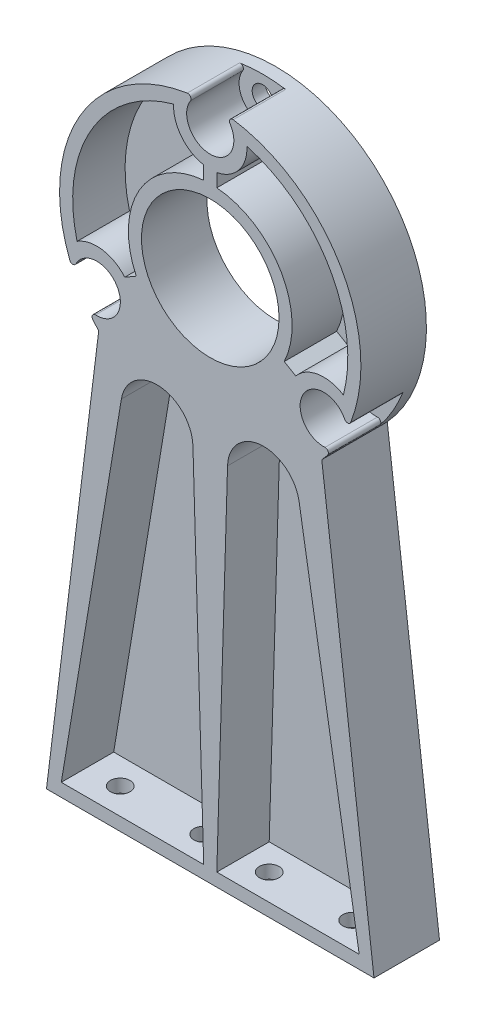
from build123d import *

# Parameters (mm, degrees)
SKETCH_1_R          = 10.5
EXTRUDE_1_DEPTH     = 10
CUT_EXTRUDE_2_DEPTH = 8
SKETCH_3_R          = 1.5
CUT_EXTRUDE_3_DEPTH = 97.81941954
EXTRUDE_START       = -10
SKETCH_4_R          = 1.6
EXTRUDE_3_DEPTH     = 10
CUT_EXTRUDE_START   = -10
SKETCH_5_R          = 1.6
CUT_EXTRUDE_4_DEPTH = 10
CUT_EXTRUDE_START_2 = -8
SKETCH_6_R          = 1.6
CUT_EXTRUDE_5_DEPTH = 8
FILLET_1_R          = 0.5


with BuildPart() as part:
    # 草图1 → 凸台-拉伸1 (new body)
    with BuildSketch(Plane.XY):
        with BuildLine():
            Line((-25, 0), (25, 0))
            Line((25, 0), (14.88676655, 81.839614547))
            ThreePointArc((14.88676655, 81.839614547), (0, 95), (-14.88676655, 81.839614547))
            Line((-14.88676655, 81.839614547), (-25, 0))
        make_face()
        with Locations((0, 80)):
            Circle(SKETCH_1_R, mode=Mode.SUBTRACT)
    extrude(amount=EXTRUDE_1_DEPTH)

    # 草图2 → 切除-拉伸2 (cut)
    with BuildSketch(Plane.XY.offset(10)):
        with BuildLine():
            Line((-13.564970556, 57.262621959), (-22.737639737, 2))
            Line((-22.737639737, 2), (-1, 2))
            Line((-1, 2), (-2.641694958, 56.527552532))
            ThreePointArc((-2.641694958, 56.527552532), (-7.769922801, 61.84962447), (-13.564970556, 57.262621959))
        make_face()
        with BuildLine():
            Line((2.641694958, 56.527552532), (1, 2))
            Line((1, 2), (22.737639737, 2))
            Line((22.737639737, 2), (13.564970556, 57.262621959))
            ThreePointArc((13.564970556, 57.262621959), (7.769922801, 61.84962447), (2.641694958, 56.527552532))
        make_face()
    extrude(amount=-CUT_EXTRUDE_2_DEPTH, mode=Mode.SUBTRACT)

    # 草图3 → 切除-拉伸3 (cut, through all)
    with BuildSketch(Plane(origin=(0, 2, 0), x_dir=(1, 0, 0), z_dir=(0, 1, 0))):
        with Locations(Location((-17.74, -6, 0), (0, 0, 180))):
            Circle(SKETCH_3_R)
        with Locations(Location((-5, -6, 0), (0, 0, 180))):
            Circle(SKETCH_3_R)
        with Locations(Location((5, -6, 0), (0, 0, 180))):
            Circle(SKETCH_3_R)
        with Locations(Location((17.74, -6, 0), (0, 0, 180))):
            Circle(SKETCH_3_R)
    extrude(amount=-CUT_EXTRUDE_3_DEPTH, mode=Mode.SUBTRACT)

    # 草图4 → 凸台-拉伸3 (add)
    with BuildSketch(Plane.XY.offset(10).offset(EXTRUDE_START)):
        with BuildLine():
            Line((16.521104317, 68.614015285), (17.025084925, 64.535638283))
            ThreePointArc((17.025084925, 64.535638283), (0, 103), (-17.025084925, 64.535638283))
            Line((-17.025084925, 64.535638283), (-16.521104317, 68.614015285))
            ThreePointArc((-16.521104317, 68.614015285), (-18.908429841, 70.196225552), (-16.207760954, 71.149692934))
            Line((-16.207760954, 71.149692934), (-14.88676655, 81.839614547))
            ThreePointArc((-14.88676655, 81.839614547), (0, 95), (14.88676655, 81.839614547))
            Line((14.88676655, 81.839614547), (16.207760954, 71.149692934))
            ThreePointArc((16.207760954, 71.149692934), (18.908429841, 70.196225552), (16.521104317, 68.614015285))
        make_face()
        with Locations((0, 100)):
            Circle(SKETCH_4_R, mode=Mode.SUBTRACT)
    extrude(amount=EXTRUDE_3_DEPTH)

    # 草图5 → 切除-拉伸4 (cut)
    with BuildSketch(Plane.XY.offset(10).offset(CUT_EXTRUDE_START)):
        with Locations((-17.320508076, 70)):
            Circle(SKETCH_5_R)
        with Locations((17.320508076, 70)):
            Circle(SKETCH_5_R)
    extrude(amount=CUT_EXTRUDE_4_DEPTH, mode=Mode.SUBTRACT)

    # 草图6 → 切除-拉伸5 (cut)
    # profile 1 of 5: a face of its own
    with BuildSketch(Plane.XY.offset(10).offset(CUT_EXTRUDE_START_2)):
        with BuildLine():
            ThreePointArc((-13.04871596, 73.621020867), (-16.480843406, 75.536692446), (-20.326626095, 74.724749142))
            ThreePointArc((-20.326626095, 74.724749142), (-18.186533479, 90.5), (-5.594811793, 100.241))
            ThreePointArc((-5.594811793, 100.241), (-4.375083977, 96.504482843), (-1, 94.490009074))
            Line((-1, 94.490009074), (-1, 92.459935794))
            ThreePointArc((-1, 92.459935794), (-10.825317547, 86.25), (-11.290620927, 74.636057507))
            Line((-11.290620927, 74.636057507), (-13.04871596, 73.621020867))
        make_face()
    # profile 2 of 5: a face of its own
    with BuildSketch(Plane.XY.offset(10).offset(CUT_EXTRUDE_START_2)):
        with BuildLine():
            ThreePointArc((2.131712692, 102.901), (0, 103), (-2.131712692, 102.901))
            ThreePointArc((-2.131712692, 102.901), (-1.625705125, 96.787978387), (3.6, 100))
            ThreePointArc((3.6, 100), (3.212021613, 101.625705125), (2.131712692, 102.901))
        make_face()
        with Locations((0, 100)):
            Circle(SKETCH_6_R, mode=Mode.SUBTRACT)
    # profile 3 of 5: a face of its own
    with BuildSketch(Plane.XY.offset(10).offset(CUT_EXTRUDE_START_2)):
        with BuildLine():
            ThreePointArc((12.5, 80), (12.193907528, 77.25070569), (11.290620927, 74.636057507))
            Line((11.290620927, 74.636057507), (13.04871596, 73.621020867))
            ThreePointArc((13.04871596, 73.621020867), (16.480843406, 75.536692446), (20.326626095, 74.724749142))
            ThreePointArc((20.326626095, 74.724749142), (18.186533479, 90.5), (5.594811793, 100.241))
            ThreePointArc((5.594811793, 100.241), (4.375083977, 96.504482843), (1, 94.490009074))
            Line((1, 94.490009074), (1, 92.459935794))
            ThreePointArc((1, 92.459935794), (9.185586535, 88.477912479), (12.5, 80))
        make_face()
    # profile 4 of 5: a face of its own
    with BuildSketch(Plane.XY.offset(10).offset(CUT_EXTRUDE_START_2)):
        with BuildLine():
            ThreePointArc((18.766991426, 66.703382655), (19.918584287, 68.5), (20.898704118, 70.395617345))
            ThreePointArc((20.898704118, 70.395617345), (14.202816622, 71.8), (18.766991426, 66.703382655))
        make_face()
        with BuildLine():
            ThreePointArc((16.207760954, 71.149692934), (17.944849571, 71.473159088), (18.920508076, 70))
            ThreePointArc((18.920508076, 70), (18.120806141, 68.614531485), (16.521104317, 68.614015285))
            ThreePointArc((16.521104317, 68.614015285), (15.73258631, 69.803774448), (16.207760954, 71.149692934))
        make_face(mode=Mode.SUBTRACT)
    # profile 5 of 5: a face of its own
    with BuildSketch(Plane.XY.offset(10).offset(CUT_EXTRUDE_START_2)):
        with BuildLine():
            ThreePointArc((-18.766991426, 66.703382655), (-15.351668324, 66.986087256), (-13.720508076, 70))
            ThreePointArc((-13.720508076, 70), (-17.122399207, 73.594544877), (-20.898704118, 70.395617345))
            ThreePointArc((-20.898704118, 70.395617345), (-19.918584287, 68.5), (-18.766991426, 66.703382655))
        make_face()
        with Locations((-17.320508076, 70)):
            Circle(SKETCH_6_R, mode=Mode.SUBTRACT)
    extrude(amount=CUT_EXTRUDE_5_DEPTH, mode=Mode.SUBTRACT)

    # 圆角1
    fillet_1_edges = [part.edges().sort_by_distance(p)[0] for p in [
        (-2.131712692, 102.901, 6),
        (2.131712692, 102.901, 6),
        (20.898704118, 70.395617345, 6),
        (18.766991426, 66.703382655, 6),
        (-18.766991426, 66.703382655, 6),
        (-20.898704118, 70.395617345, 6),
    ]]
    fillet(fillet_1_edges, radius=FILLET_1_R)


solid = part.part
